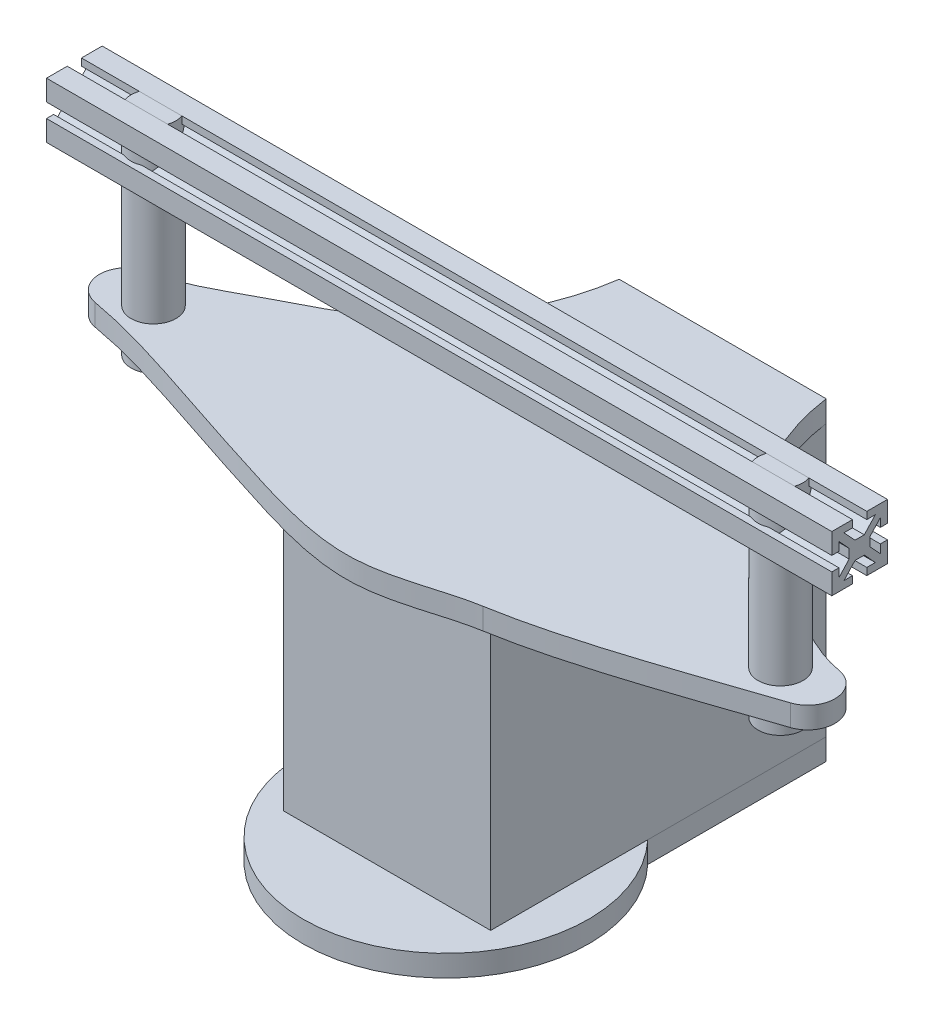
from build123d import *

# Parameters (mm, degrees)
BOSS_EXTRUDE1_DEPTH      = 3
SKETCH2_W                = 29
SKETCH2_H                = 47
BOSS_EXTRUDE2_DEPTH      = 38
SKETCH3_W                = 29
SKETCH3_H                = 47
BOSS_EXTRUDE3_DEPTH      = 3
SKETCH4_R                = 7
CUT_EXTRUDE2_DEPTH       = 2
BOSS_EXTRUDE4_DEPTH      = 24
BOSS_EXTRUDE4_DEPTH_BACK = 6
SKETCH5_R                = 3.15
BOSS_EXTRUDE5_DEPTH      = 55
BOSS_EXTRUDE5_DEPTH_BACK = 55


with BuildPart() as part:
    # Sketch1 → Boss-Extrude1 (new body)
    with BuildSketch(Plane(origin=(0, 0, 0), x_dir=(1, 0, 0), z_dir=(0, 1, 0))):
        with BuildLine():
            Line((-14.5, 38.774977314), (14.5, 38.774977314))
            Line((14.5, 38.774977314), (14.5, 13.774977314))
            ThreePointArc((14.5, 13.774977314), (0, -20), (-14.5, 13.774977314))
            Line((-14.5, 13.774977314), (-14.5, 38.774977314))
        make_face()
    extrude(amount=BOSS_EXTRUDE1_DEPTH)

    # Sketch4 → Cut-Extrude2 (cut)
    with BuildSketch(Plane.XZ):
        with Locations(Location((0, 0, 0), (0, 0, 270))):
            Circle(SKETCH4_R)
    extrude(amount=-CUT_EXTRUDE2_DEPTH, mode=Mode.SUBTRACT)


with BuildPart() as body_2:
    # Sketch2 → Boss-Extrude2 (new body)
    with BuildSketch(Plane(origin=(0, 3, 0), x_dir=(1, 0, 0), z_dir=(0, 1, 0))):
        with Locations((0, 15.274977314)):
            Rectangle(SKETCH2_W, SKETCH2_H)
    extrude(amount=BOSS_EXTRUDE2_DEPTH)

    # Sketch3 → Boss-Extrude3 (add)
    with BuildSketch(Plane(origin=(0, 41, 0), x_dir=(1, 0, 0), z_dir=(0, 1, 0))):
        with BuildLine():
            add(Edge.make_bspline(
                [(-48.403293038, -0.738448708), (-46.722077864, -1.052422756), (-39.364385354, -2.560583108), (-22.668282111, -8.654314983), (1.61249857, -15.747307167), (10.728352261, -11.256041418), (15.631641737, -10.432634197)],
                knots=[0.248885178, 0.248885178, 0.248885178, 0.248885178, 0.339972432, 0.6300827, 0.771871401, 0.935575436, 0.935575436, 0.935575436, 0.935575436], degree=3))
            add(Edge.make_bspline(
                [(15.631641737, -10.432634197), (24.752270132, -8.901011128), (37.108839409, -4.596412261), (47.624465638, -1.035325657), (48.905767222, -0.608487049)],
                knots=[0.030067832, 0.030067832, 0.030067832, 0.030067832, 0.543781053, 0.617485769, 0.617485769, 0.617485769, 0.617485769], degree=3))
            ThreePointArc((48.905767222, -0.608487049), (51.488843103, 3.280831008), (48.341687977, 6.729670026))
            add(Edge.make_bspline(
                [(14.5, 38.774977314), (15.567965131, 30.93381812), (22.220147325, 18.615244813), (37.203490403, 11.889028242), (44.639099785, 7.358117597), (48.341687977, 6.729670026)],
                knots=[0, 0, 0, 0, 0.490598959, 0.765051405, 1, 1, 1, 1], degree=3))
            Line((14.5, 38.774977314), (14.5, -8.225022686))
            Line((14.5, -8.225022686), (-14.5, -8.225022686))
            Line((-14.5, -8.225022686), (-14.5, 38.774977314))
            add(Edge.make_bspline(
                [(-14.5, 38.774977314), (-15.567965131, 30.93381812), (-22.220147325, 18.615244813), (-37.203490403, 11.889028242), (-44.639099785, 7.358117597), (-48.341687977, 6.729670026)],
                knots=[0, 0, 0, 0, 0.490598959, 0.765051405, 1, 1, 1, 1], degree=3))
            ThreePointArc((-48.341687977, 6.729670026), (-51.499870954, 3.02140865), (-48.403293038, -0.738448708))
        make_face()
        with Locations((0, 15.274977314)):
            Rectangle(SKETCH3_W, SKETCH3_H)
    extrude(amount=BOSS_EXTRUDE3_DEPTH)

    # Sketch5 → Boss-Extrude4 (add, two sides: drawn at the far end of the back side and taken through both)
    with BuildSketch(Plane(origin=(0, 44, 0), x_dir=(1, 0, 0), z_dir=(0, 1, 0)).offset(-BOSS_EXTRUDE4_DEPTH_BACK)):
        with Locations(Location((-43.914062889, 2.958832761, 0), (0, 0, 270))):
            Circle(SKETCH5_R)
        with Locations(Location((43.914062889, 2.958832761, 0), (0, 0, 270))):
            Circle(SKETCH5_R)
    extrude(amount=BOSS_EXTRUDE4_DEPTH + BOSS_EXTRUDE4_DEPTH_BACK)


with BuildPart() as body_3:
    # Sketch6 → Boss-Extrude5 (new, two sides: drawn at the far end of the back side and taken through both)
    with BuildSketch(Plane(origin=(0, 0, 0), x_dir=(0, 0, -1), z_dir=(1, 0, 0)).offset(-BOSS_EXTRUDE5_DEPTH_BACK)):
        Polygon((3.958832761, 61.2), (3.958832761, 60.2), (6.858832761, 60.2), (6.858832761, 63.1), (5.858832761, 63.1), (5.858832761, 61.907657541), (4.43363813, 63.45), (4.43363813, 64.75), (5.858832761, 66.292342459), (5.858832761, 65.1), (6.858832761, 65.1), (6.858832761, 68), (6.108832761, 68), (3.958832761, 68), (3.958832761, 67), (5.151175221, 67), (3.608832761, 65.330880423), (2.308832761, 65.330880423), (0.766490302, 67), (1.958832761, 67), (1.958832761, 68), (-0.191167239, 68), (-0.941167239, 68), (-0.941167239, 65.1), (0.058832761, 65.1), (0.058832761, 66.292342459), (1.484027393, 64.75), (1.484027393, 63.45), (0.058832761, 61.907657541), (0.058832761, 63.1), (-0.941167239, 63.1), (-0.941167239, 60.2), (1.958832761, 60.2), (1.958832761, 61.2), (0.766490302, 61.2), (2.308832761, 62.869119577), (3.608832761, 62.869119577), (5.151175221, 61.2), align=None)
    extrude(amount=BOSS_EXTRUDE5_DEPTH + BOSS_EXTRUDE5_DEPTH_BACK)


solid = Compound([part.part, body_2.part, body_3.part])
